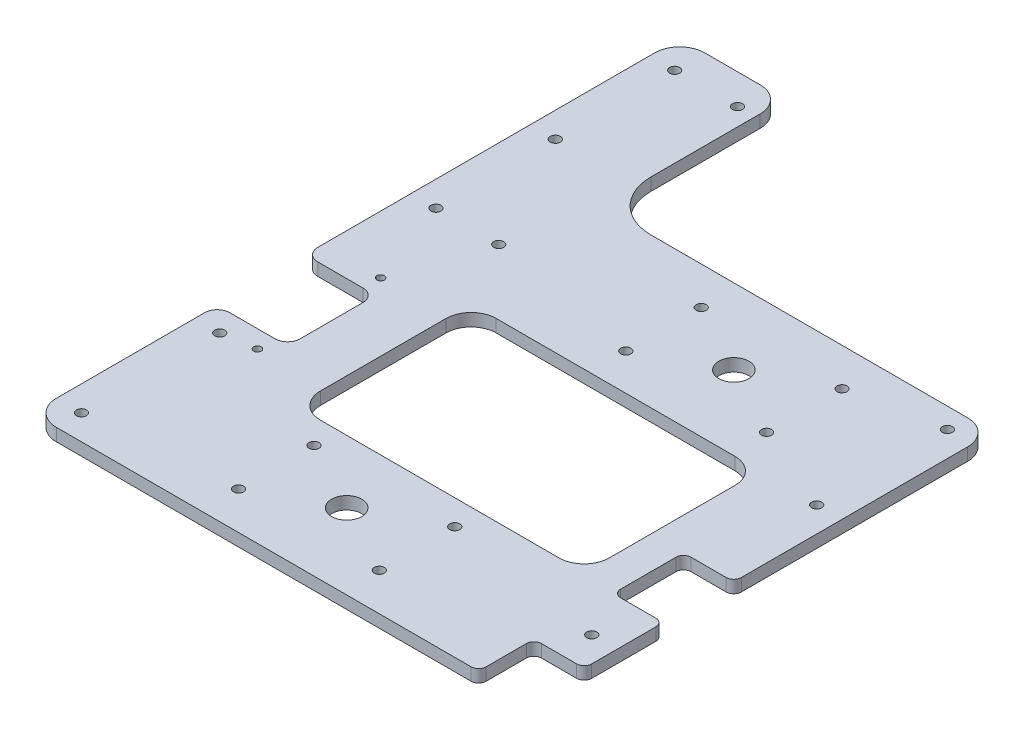
from build123d import *

# Parameters (mm, degrees)
SKETCH_1_W           = 213
SKETCH_1_H           = 190
EXTRUDE_1_DEPTH      = 5
SKETCH_2_R           = 2
SKETCH_2_R_2         = 6
CUT_EXTRUDE_1_DEPTH  = 143.801435567
SKETCH_3_W           = 213
SKETCH_3_H           = 5.445794932
CUT_EXTRUDE_2_DEPTH  = 143.801435567
SKETCH_4_W           = 28
SKETCH_4_H           = 35
CUT_EXTRUDE_3_DEPTH  = 143.801435567
FILLET_1_R           = 5
SKETCH_5_W           = 42
SKETCH_5_H           = 73.445794932
EXTRUDE_2_DEPTH      = 5
FILLET_2_R           = 20
SKETCH_6_R           = 2
CUT_EXTRUDE_4_DEPTH  = 200.352039946
SKETCH_7_R           = 2
CUT_EXTRUDE_5_DEPTH  = 200.352039946
SKETCH_8_W           = 20
SKETCH_8_H           = 22
SKETCH_8_H_2         = 28
CUT_EXTRUDE_6_DEPTH  = 200.352039946
FILLET_3_R           = 3
SKETCH_9_W           = 18
SKETCH_9_H           = 22
CUT_EXTRUDE_7_DEPTH  = 200.352039946
SKETCH_10_R          = 1.5
CUT_EXTRUDE_8_DEPTH  = 200.352039946
FILLET_4_R           = 10
SKETCH_11_W          = 115
SKETCH_11_H          = 70
CUT_EXTRUDE_9_DEPTH  = 200.352039946
FILLET_5_R           = 10
SKETCH_12_W          = 19.993467056
SKETCH_12_H          = 162.554205068
CUT_EXTRUDE_10_DEPTH = 200.352039946
FILLET_6_R           = 3
FILLET_7_R           = 10


with BuildPart() as part:
    # 草图1 → 凸台-拉伸1 (new body)
    with BuildSketch(Plane(origin=(0, 0, 0), x_dir=(1, 0, 0), z_dir=(0, 1, 0))):
        Rectangle(SKETCH_1_W, SKETCH_1_H)
    extrude(amount=EXTRUDE_1_DEPTH)

    # 草图2 → 切除-拉伸1 (cut, through all)
    with BuildSketch(Plane(origin=(0, 5, 0), x_dir=(1, 0, 0), z_dir=(0, 1, 0))):
        with Locations(Location((-9.5, 80, 0), (0, 0, 270))):
            Circle(SKETCH_2_R)
        with Locations(Location((46.5, 80, 0), (0, 0, 270))):
            Circle(SKETCH_2_R)
        with Locations(Location((-9.5, 50, 0), (0, 0, 270))):
            Circle(SKETCH_2_R)
        with Locations(Location((46.5, 50, 0), (0, 0, 270))):
            Circle(SKETCH_2_R)
        with Locations(Location((-39, -44.554205068, 0), (0, 0, 270))):
            Circle(SKETCH_2_R)
        with Locations(Location((17, -44.554205068, 0), (0, 0, 270))):
            Circle(SKETCH_2_R)
        with Locations(Location((17, -74.554205068, 0), (0, 0, 270))):
            Circle(SKETCH_2_R)
        with Locations(Location((-39, -74.554205068, 0), (0, 0, 270))):
            Circle(SKETCH_2_R)
        with Locations(Location((-11, -59.554205068, 0), (0, 0, 270))):
            Circle(SKETCH_2_R_2)
        with Locations(Location((18.5, 65, 0), (0, 0, 270))):
            Circle(SKETCH_2_R_2)
    extrude(amount=-CUT_EXTRUDE_1_DEPTH, mode=Mode.SUBTRACT)

    # 草图3 → 切除-拉伸2 (cut, through all)
    with BuildSketch(Plane(origin=(0, 5, 0), x_dir=(1, 0, 0), z_dir=(0, 1, 0))):
        with Locations((0, -92.277102534)):
            Rectangle(SKETCH_3_W, SKETCH_3_H)
    extrude(amount=-CUT_EXTRUDE_2_DEPTH, mode=Mode.SUBTRACT)

    # 草图4 → 切除-拉伸3 (cut, through all)
    with BuildSketch(Plane(origin=(0, 5, 0), x_dir=(1, 0, 0), z_dir=(0, 1, 0))):
        with Locations((-92.5, 1.945794932)):
            Rectangle(SKETCH_4_W, SKETCH_4_H)
    extrude(amount=-CUT_EXTRUDE_3_DEPTH, mode=Mode.SUBTRACT)

    # 圆角1
    fillet_1_edges = [part.edges().sort_by_distance(p)[0] for p in [
        (-106.5, 2.5, 15.554205068),
        (-106.5, 2.5, -19.445794932),
        (-78.5, 2.5, -19.445794932),
        (-78.5, 2.5, 15.554205068),
    ]]
    fillet(fillet_1_edges, radius=FILLET_1_R)

    # 草图5 → 凸台-拉伸2 (add)
    with BuildSketch(Plane(origin=(0, 5, 0), x_dir=(1, 0, 0), z_dir=(0, 1, 0))):
        with Locations((-85.5, 131.722897466)):
            Rectangle(SKETCH_5_W, SKETCH_5_H)
    extrude(amount=-EXTRUDE_2_DEPTH)

    # 圆角2
    fillet_2_edges = [part.edges().sort_by_distance(p)[0] for p in [
        (-64.5, 2.5, -95),
    ]]
    fillet(fillet_2_edges, radius=FILLET_2_R)

    # 草图6 → 切除-拉伸4 (cut, through all)
    with BuildSketch(Plane(origin=(0, 5, 0), x_dir=(1, 0, 0), z_dir=(0, 1, 0))):
        with Locations(Location((-96.5, 156.445794932, 0), (0, 0, 270))):
            Circle(SKETCH_6_R)
        with Locations(Location((-71.5, 156.445794932, 0), (0, 0, 270))):
            Circle(SKETCH_6_R)
        with Locations(Location((-71.5, 61.445794932, 0), (0, 0, 270))):
            Circle(SKETCH_6_R)
        with Locations(Location((-96.5, 61.445794932, 0), (0, 0, 270))):
            Circle(SKETCH_6_R)
    extrude(amount=-CUT_EXTRUDE_4_DEPTH, mode=Mode.SUBTRACT)

    # 草图7 → 切除-拉伸5 (cut, through all)
    with BuildSketch(Plane(origin=(0, 5, 0), x_dir=(1, 0, 0), z_dir=(0, 1, 0))):
        with Locations(Location((-96.5, 108.945794932, 0), (0, 0, 270))):
            Circle(SKETCH_7_R)
        with Locations(Location((-96.5, -24.554205068, 0), (0, 0, 270))):
            Circle(SKETCH_7_R)
        with Locations(Location((-96.5, -79.554205068, 0), (0, 0, 270))):
            Circle(SKETCH_7_R)
        with Locations(Location((81.5, 86.945794932, 0), (0, 0, 270))):
            Circle(SKETCH_7_R)
        with Locations(Location((81.5, 34.945794932, 0), (0, 0, 270))):
            Circle(SKETCH_7_R)
        with Locations(Location((81.5, -54.554205068, 0), (0, 0, 270))):
            Circle(SKETCH_7_R)
    extrude(amount=-CUT_EXTRUDE_5_DEPTH, mode=Mode.SUBTRACT)

    # 草图8 → 切除-拉伸6 (cut, through all)
    with BuildSketch(Plane(origin=(0, 5, 0), x_dir=(1, 0, 0), z_dir=(0, 1, 0))):
        with Locations((81.5, -78.554205068)):
            Rectangle(SKETCH_8_W, SKETCH_8_H)
        with Locations((81.5, -22.054205068)):
            Rectangle(SKETCH_8_W, SKETCH_8_H_2)
    extrude(amount=-CUT_EXTRUDE_6_DEPTH, mode=Mode.SUBTRACT)

    # 圆角3
    fillet_3_edges = [part.edges().sort_by_distance(p)[0] for p in [
        (91.5, 2.5, 89.554205068),
        (71.5, 2.5, 89.554205068),
        (71.5, 2.5, 67.554205068),
        (91.5, 2.5, 67.554205068),
        (71.5, 2.5, 36.054205068),
        (71.5, 2.5, 8.054205068),
    ]]
    fillet(fillet_3_edges, radius=FILLET_3_R)

    # 草图9 → 切除-拉伸7 (cut, through all)
    with BuildSketch(Plane(origin=(0, 5, 0), x_dir=(1, 0, 0), z_dir=(0, 1, 0))):
        with Locations((97.5, -78.554205068)):
            Rectangle(SKETCH_9_W, SKETCH_9_H)
    extrude(amount=-CUT_EXTRUDE_7_DEPTH, mode=Mode.SUBTRACT)

    # 草图10 → 切除-拉伸8 (cut, through all)
    with BuildSketch(Plane(origin=(0, 5, 0), x_dir=(1, 0, 0), z_dir=(0, 1, 0))):
        with Locations(Location((-83.5, 26.445794932, 0), (0, 0, 270))):
            Circle(SKETCH_10_R)
        with Locations(Location((-83.5, -22.554205068, 0), (0, 0, 270))):
            Circle(SKETCH_10_R)
    extrude(amount=-CUT_EXTRUDE_8_DEPTH, mode=Mode.SUBTRACT)

    # 圆角4
    fillet_4_edges = [part.edges().sort_by_distance(p)[0] for p in [
        (-106.5, 2.5, -168.445794932),
        (-64.5, 2.5, -168.445794932),
        (106.5, 2.5, 67.554205068),
        (-106.5, 2.5, 89.554205068),
        (106.5, 2.5, -95),
    ]]
    fillet(fillet_4_edges, radius=FILLET_4_R)

    # 草图11 → 切除-拉伸9 (cut, through all)
    with BuildSketch(Plane(origin=(0, 5, 0), x_dir=(1, 0, 0), z_dir=(0, 1, 0))):
        with Locations((1, 0.445794932)):
            Rectangle(SKETCH_11_W, SKETCH_11_H)
    extrude(amount=-CUT_EXTRUDE_9_DEPTH, mode=Mode.SUBTRACT)

    # 圆角5
    fillet_5_edges = [part.edges().sort_by_distance(p)[0] for p in [
        (-56.5, 2.5, 34.554205068),
        (-56.5, 2.5, -35.445794932),
        (58.5, 2.5, -35.445794932),
        (58.5, 2.5, 34.554205068),
    ]]
    fillet(fillet_5_edges, radius=FILLET_5_R)

    # 草图12 → 切除-拉伸10 (cut, through all)
    with BuildSketch(Plane(origin=(0, 5, 0), x_dir=(1, 0, 0), z_dir=(0, 1, 0))):
        with Locations((101.496733528, 13.722897466)):
            Rectangle(SKETCH_12_W, SKETCH_12_H)
    extrude(amount=-CUT_EXTRUDE_10_DEPTH, mode=Mode.SUBTRACT)

    # 圆角6
    fillet_6_edges = [part.edges().sort_by_distance(p)[0] for p in [
        (91.5, 2.5, 36.054205068),
        (91.5, 2.5, 8.054205068),
        (91.5, 2.5, 67.554205068),
    ]]
    fillet(fillet_6_edges, radius=FILLET_6_R)

    # 圆角7
    fillet_7_edges = [part.edges().sort_by_distance(p)[0] for p in [
        (91.5, 2.5, -95),
    ]]
    fillet(fillet_7_edges, radius=FILLET_7_R)


solid = part.part
